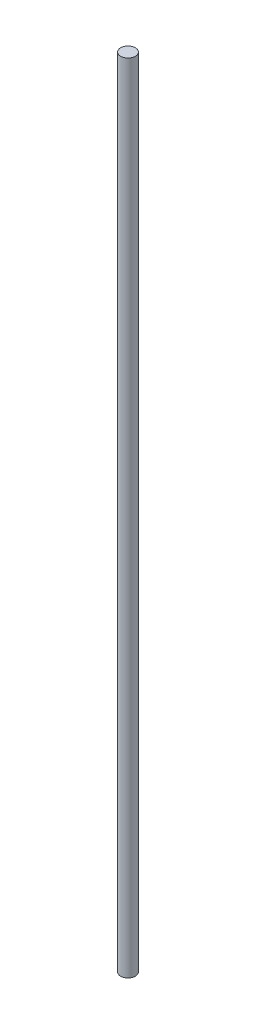
from build123d import *

# Parameters (mm, degrees)
SKETCH_1_R      = 4
EXTRUDE_1_DEPTH = 432


with BuildPart() as part:
    # 草图1 → 凸台-拉伸1 (new body)
    with BuildSketch(Plane(origin=(0, 0, 0), x_dir=(1, 0, 0), z_dir=(0, 1, 0))):
        with Locations(Location((0, 0, 0), (0, 0, 270))):
            Circle(SKETCH_1_R)
    extrude(amount=EXTRUDE_1_DEPTH)


solid = part.part
